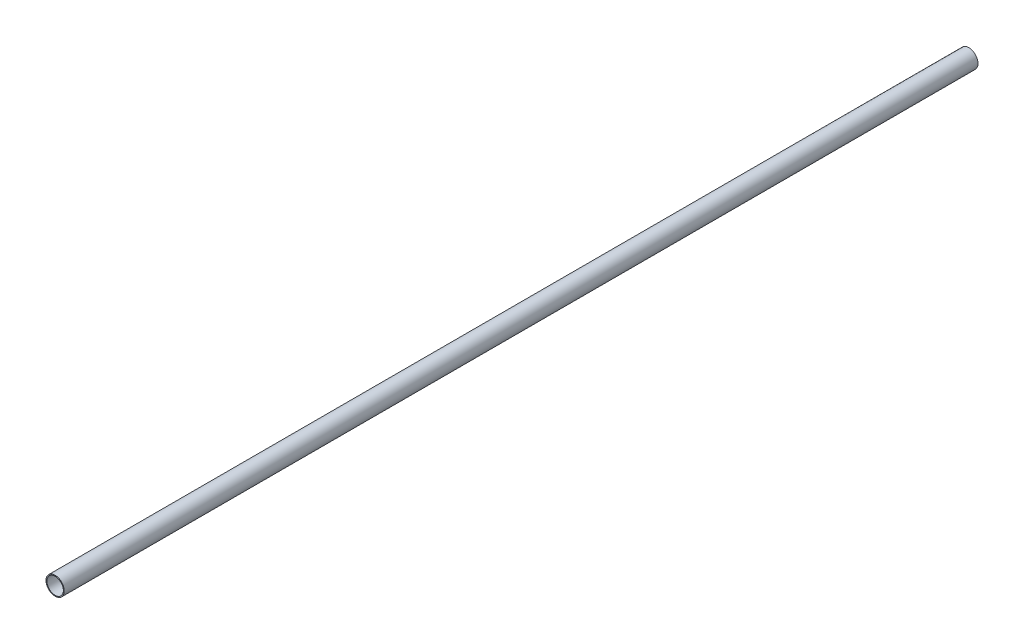
from build123d import *

# Parameters (mm, degrees)
SKETCH_1_R      = 10
SKETCH_1_R_2    = 9
EXTRUDE_1_DEPTH = 1000


with BuildPart() as part:
    # Эскиз1 → Бобышка-Вытянуть1 (new body)
    with BuildSketch(Plane.XY):
        Circle(SKETCH_1_R)
        Circle(SKETCH_1_R_2, mode=Mode.SUBTRACT)
    extrude(amount=EXTRUDE_1_DEPTH)


solid = part.part
